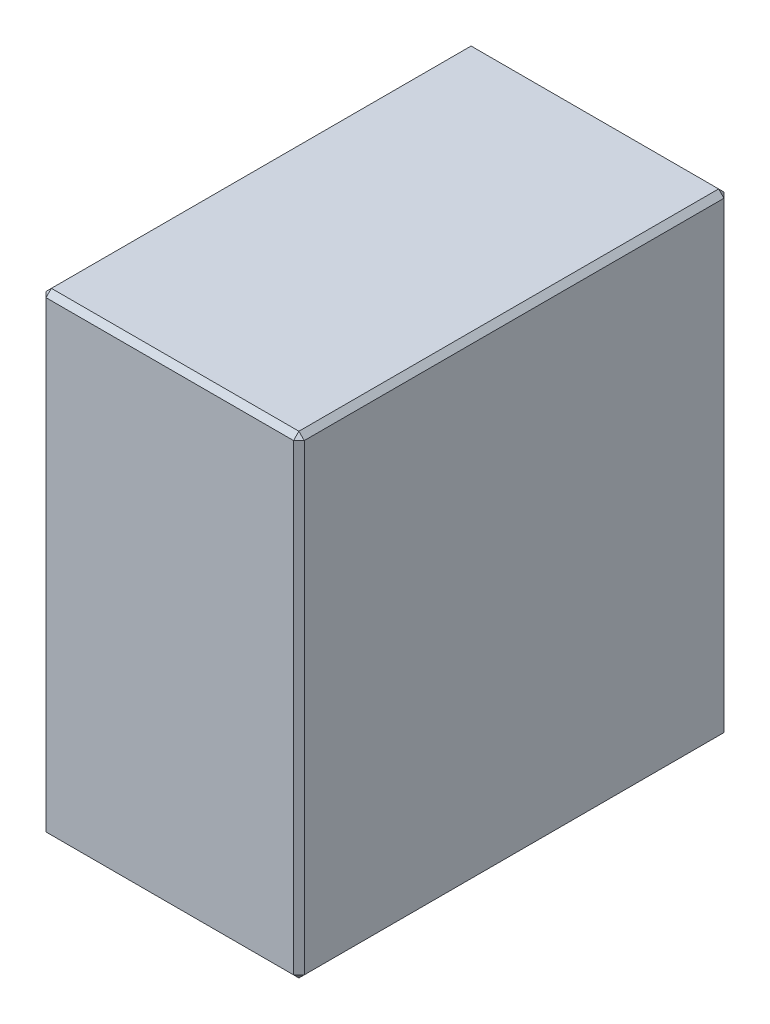
from build123d import *

# Parameters (mm, degrees)
SKETCH1_W                  = 20
SKETCH1_H                  = 22
BOSS_EXTRUDE1_DEPTH        = 12
HOLE1_D                    = 4.92
HOLE1_DEPTH                = 11
HOLE1_TIP                  = 1.478117123
M3_5_CLEARANCE_HOLE1_D     = 4.13
M3_5_CLEARANCE_HOLE1_DEPTH = 12
M3_5_CLEARANCE_HOLE1_TIP   = 1.240777178
CHAMFER1_SIZE              = 0.25


with BuildPart() as part:
    # Sketch1 → Boss-Extrude1 (new body)
    with BuildSketch(Plane(origin=(0, 0, 0), x_dir=(0, 0, -1), z_dir=(1, 0, 0))):
        with Locations((10, 11)):
            Rectangle(SKETCH1_W, SKETCH1_H)
    extrude(amount=-BOSS_EXTRUDE1_DEPTH)

    # Hole1
    with Locations(Plane(origin=(0, 0, -20), x_dir=(-1, 0, 0), z_dir=(0, 0, -1))):
        with Locations((6, 17)):
            Hole(HOLE1_D / 2, depth=HOLE1_DEPTH)
            with Locations((0, 0, -(HOLE1_DEPTH + HOLE1_TIP / 2))):  # 118° drill point
                Cone(0, HOLE1_D / 2, HOLE1_TIP, mode=Mode.SUBTRACT)

    # M3.5 Clearance Hole1
    with Locations(Plane(origin=(0, 0, 0), x_dir=(-1, 0, 0), z_dir=(0, -1, 0))):
        with Locations((6, 16), (6, 6)):
            Hole(M3_5_CLEARANCE_HOLE1_D / 2, depth=M3_5_CLEARANCE_HOLE1_DEPTH)
            with Locations((0, 0, -(M3_5_CLEARANCE_HOLE1_DEPTH + M3_5_CLEARANCE_HOLE1_TIP / 2))):  # 118° drill point
                Cone(0, M3_5_CLEARANCE_HOLE1_D / 2, M3_5_CLEARANCE_HOLE1_TIP, mode=Mode.SUBTRACT)

    # Chamfer1
    chamfer1_edges = [part.edges().sort_by_distance(p)[0] for p in [
        (-12, 11, -20),
        (-12, 22, -10),
        (-12, 11, 0),
        (0, 22, -10),
        (0, 11, -20),
        (0, 0, -10),
        (0, 11, 0),
        (-6, 22, 0),
        (-6, 22, -20),
        (-6, 0, -20),
        (-6, 0, 0),
        (-12, 0, -10),
    ]]
    chamfer(chamfer1_edges, length=CHAMFER1_SIZE)


solid = part.part
